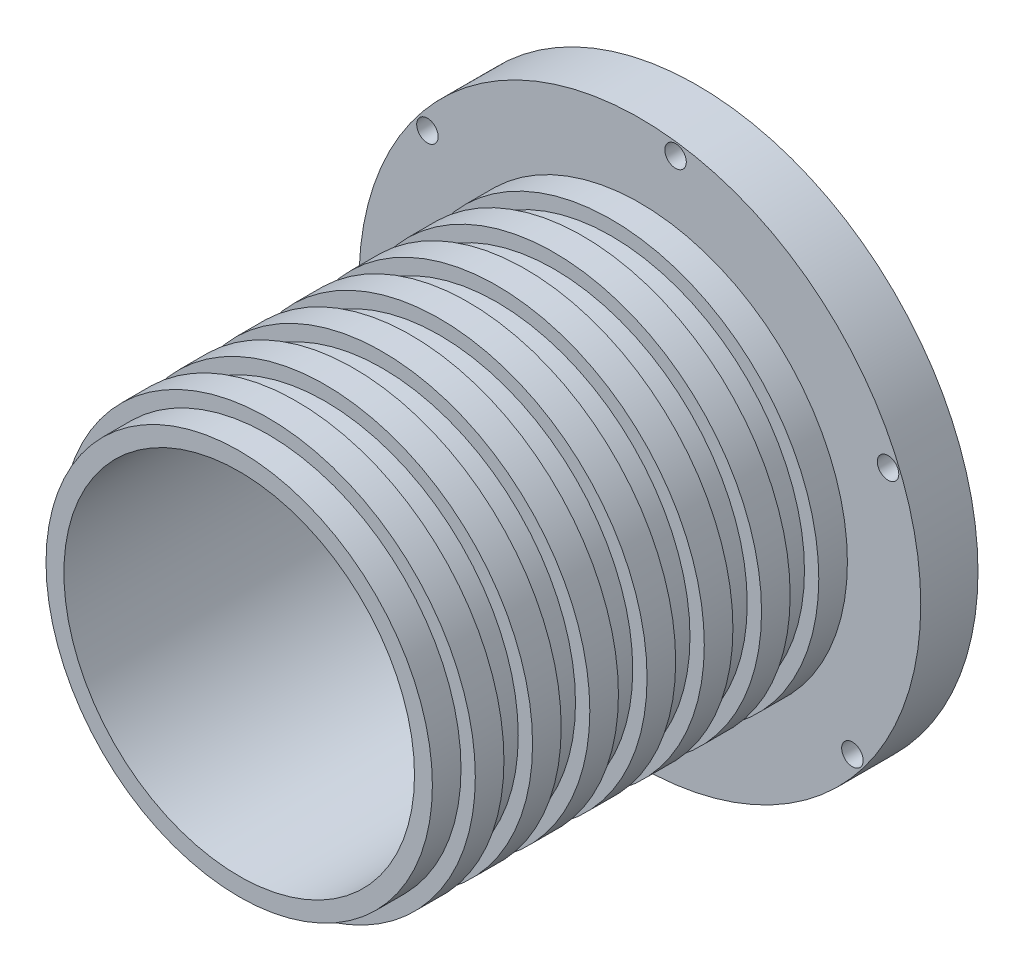
from build123d import *

# Parameters (mm, degrees)
SKETCH1_R           = 28
BOSS_EXTRUDE1_DEPTH = 4
SKETCH2_R           = 39.25
BOSS_EXTRUDE2_DEPTH = 8
SKETCH4_R           = 27
BOSS_EXTRUDE3_DEPTH = 56
SKETCH5_R           = 24.5
CUT_EXTRUDE2_DEPTH  = 88.778841414
SKETCH6_R           = 29
BOSS_EXTRUDE4_DEPTH = 4
LPATTERN1_COUNT     = 7
LPATTERN1_PITCH     = 8
SKETCH8_R           = 1.5
CUT_EXTRUDE3_DEPTH  = 79.848747612
CIRPATTERN1_COUNT   = 6
SKETCH9_R           = 24.5
CUT_EXTRUDE4_DEPTH  = 85.71791428


with BuildPart() as part:
    # Sketch1 → Boss-Extrude1 (new body)
    with BuildSketch(Plane.XY):
        Circle(SKETCH1_R)
    extrude(amount=BOSS_EXTRUDE1_DEPTH)

    # Sketch2 → Boss-Extrude2 (add)
    with BuildSketch(Plane.XY.offset(4)):
        Circle(SKETCH2_R)
    extrude(amount=BOSS_EXTRUDE2_DEPTH)

    # Sketch4 → Boss-Extrude3 (add)
    with BuildSketch(Plane.XY.offset(12)):
        Circle(SKETCH4_R)
    extrude(amount=BOSS_EXTRUDE3_DEPTH)

    # Sketch5 → Cut-Extrude2 (cut, through all)
    with BuildSketch(Plane.XY.offset(68)):
        Circle(SKETCH5_R)
    extrude(amount=-CUT_EXTRUDE2_DEPTH, mode=Mode.SUBTRACT)

    # Sketch6 → Boss-Extrude4 (add)
    with BuildSketch(Plane.XY.offset(12)):
        Circle(SKETCH6_R)
    boss_extrude4 = extrude(amount=BOSS_EXTRUDE4_DEPTH)

    # LPattern1: Boss-Extrude4 ×7
    with Locations(*[(0, 0, i * LPATTERN1_PITCH) for i in range(1, LPATTERN1_COUNT)]):
        add(boss_extrude4)

    # Sketch8 → Cut-Extrude3 (cut, through all)
    with BuildSketch(Plane.XY.offset(12)):
        with Locations((4.985240287, 37.167154576)):
            Circle(SKETCH8_R)
    cut_extrude3 = extrude(amount=-CUT_EXTRUDE3_DEPTH, mode=Mode.SUBTRACT)

    # CirPattern1: Cut-Extrude3 ×6 about axis
    cirpattern1_axis = Axis((0, 0, 0), (0, 0, 1))
    for i in range(1, CIRPATTERN1_COUNT):
        add(cut_extrude3.rotate(cirpattern1_axis, i * 360 / CIRPATTERN1_COUNT), mode=Mode.SUBTRACT)

    # Sketch9 → Cut-Extrude4 (cut, through all)
    with BuildSketch(Plane.XY.offset(64)):
        Circle(SKETCH9_R)
    extrude(amount=-CUT_EXTRUDE4_DEPTH, mode=Mode.SUBTRACT)


solid = part.part
